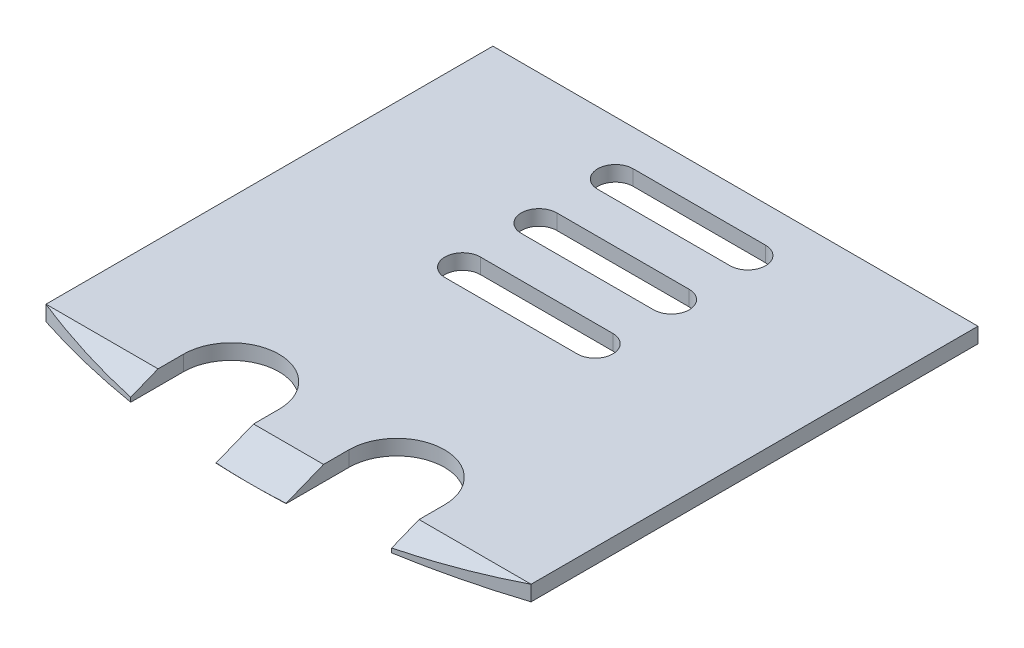
from build123d import *

# Parameters (mm, degrees)
BOSS_EXTRUDE1_DEPTH     = 0.6
CUT_EXTRUDE1_DEPTH      = 14.483740208
CUT_EXTRUDE1_DEPTH_BACK = 14.483740208
CUT_EXTRUDE2_REACH      = 15.484


with BuildPart() as part:
    # Sketch1 → Boss-Extrude1 (new body)
    with BuildSketch(Plane(origin=(0, 0, 0), x_dir=(1, 0, 0), z_dir=(0, 1, 0))):
        with BuildLine():
            Line((-5.125, -7.025), (-5.125, -9.098312567))
            ThreePointArc((-5.125, -9.098312567), (-7.344632392, -8.642138452), (-9.525, -8.025))
            Line((-9.525, -8.025), (-9.525, 9.525))
            Line((-9.525, 9.525), (9.525, 9.525))
            Line((9.525, 9.525), (9.525, -8.025))
            ThreePointArc((9.525, -8.025), (7.344632392, -8.642138452), (5.125, -9.098312567))
            Line((5.125, -9.098312567), (5.125, -7.025))
            ThreePointArc((5.125, -7.025), (3.25, -5.15), (1.375, -7.025))
            Line((1.375, -7.025), (1.375, -9.494483029))
            ThreePointArc((1.375, -9.494483029), (0, -9.525), (-1.375, -9.494483029))
            Line((-1.375, -9.494483029), (-1.375, -7.025))
            ThreePointArc((-1.375, -7.025), (-3.25, -5.15), (-5.125, -7.025))
        make_face()
    extrude(amount=BOSS_EXTRUDE1_DEPTH)

    # Sketch2 → Cut-Extrude1 (cut, two sides: drawn at the far end of the back side and taken through both)
    with BuildSketch(Plane(origin=(0, 0, 0), x_dir=(0, 0, -1), z_dir=(1, 0, 0)).offset(-CUT_EXTRUDE1_DEPTH_BACK)):
        Polygon((-9.525, 0), (-8.025, 0.6), (-9.525, 0.6), align=None)
    extrude(amount=CUT_EXTRUDE1_DEPTH + CUT_EXTRUDE1_DEPTH_BACK, mode=Mode.SUBTRACT)

    # Sketch3 → Cut-Extrude2 (cut, up to next)
    with BuildSketch(Plane(origin=(0, 0.6, 0), x_dir=(1, 0, 0), z_dir=(0, 1, 0)), mode=Mode.PRIVATE) as cut_extrude2_sk1:
        with BuildLine():
            Line((2.5992936, 6.713604042), (-2.5992936, 6.713604042))
            ThreePointArc((-2.5992936, 6.713604042), (-3.297389596, 7.411700037), (-2.5992936, 8.109796033))
            Line((-2.5992936, 8.109796033), (2.5992936, 8.109796033))
            ThreePointArc((2.5992936, 8.109796033), (3.297389596, 7.411700037), (2.5992936, 6.713604042))
        make_face()
    cut_extrude2_tool1 = extrude(cut_extrude2_sk1.sketch, amount=-CUT_EXTRUDE2_REACH, mode=Mode.PRIVATE) & part.part
    # Sketch3 → Cut-Extrude2 (cut, up to next)
    with BuildSketch(Plane(origin=(0, 0.6, 0), x_dir=(1, 0, 0), z_dir=(0, 1, 0)), mode=Mode.PRIVATE) as cut_extrude2_sk2:
        with BuildLine():
            Line((2.5992936, 3.713604042), (-2.5992936, 3.713604042))
            ThreePointArc((-2.5992936, 3.713604042), (-3.297389596, 4.411700037), (-2.5992936, 5.109796033))
            Line((-2.5992936, 5.109796033), (2.5992936, 5.109796033))
            ThreePointArc((2.5992936, 5.109796033), (3.297389596, 4.411700037), (2.5992936, 3.713604042))
        make_face()
    cut_extrude2_tool2 = extrude(cut_extrude2_sk2.sketch, amount=-CUT_EXTRUDE2_REACH, mode=Mode.PRIVATE) & part.part
    # Sketch3 → Cut-Extrude2 (cut, up to next)
    with BuildSketch(Plane(origin=(0, 0.6, 0), x_dir=(1, 0, 0), z_dir=(0, 1, 0)), mode=Mode.PRIVATE) as cut_extrude2_sk3:
        with BuildLine():
            Line((2.5992936, 0.713604042), (-2.5992936, 0.713604042))
            ThreePointArc((-2.5992936, 0.713604042), (-3.297389596, 1.411700037), (-2.5992936, 2.109796033))
            Line((-2.5992936, 2.109796033), (2.5992936, 2.109796033))
            ThreePointArc((2.5992936, 2.109796033), (3.297389596, 1.411700037), (2.5992936, 0.713604042))
        make_face()
    cut_extrude2_tool3 = extrude(cut_extrude2_sk3.sketch, amount=-CUT_EXTRUDE2_REACH, mode=Mode.PRIVATE) & part.part
    add(cut_extrude2_tool1.solids().sort_by_distance((0, 0.6, -7.4117))[0], mode=Mode.SUBTRACT)
    add(cut_extrude2_tool2.solids().sort_by_distance((0, 0.6, -4.4117))[0], mode=Mode.SUBTRACT)
    add(cut_extrude2_tool3.solids().sort_by_distance((0, 0.6, -1.4117))[0], mode=Mode.SUBTRACT)


solid = part.part
